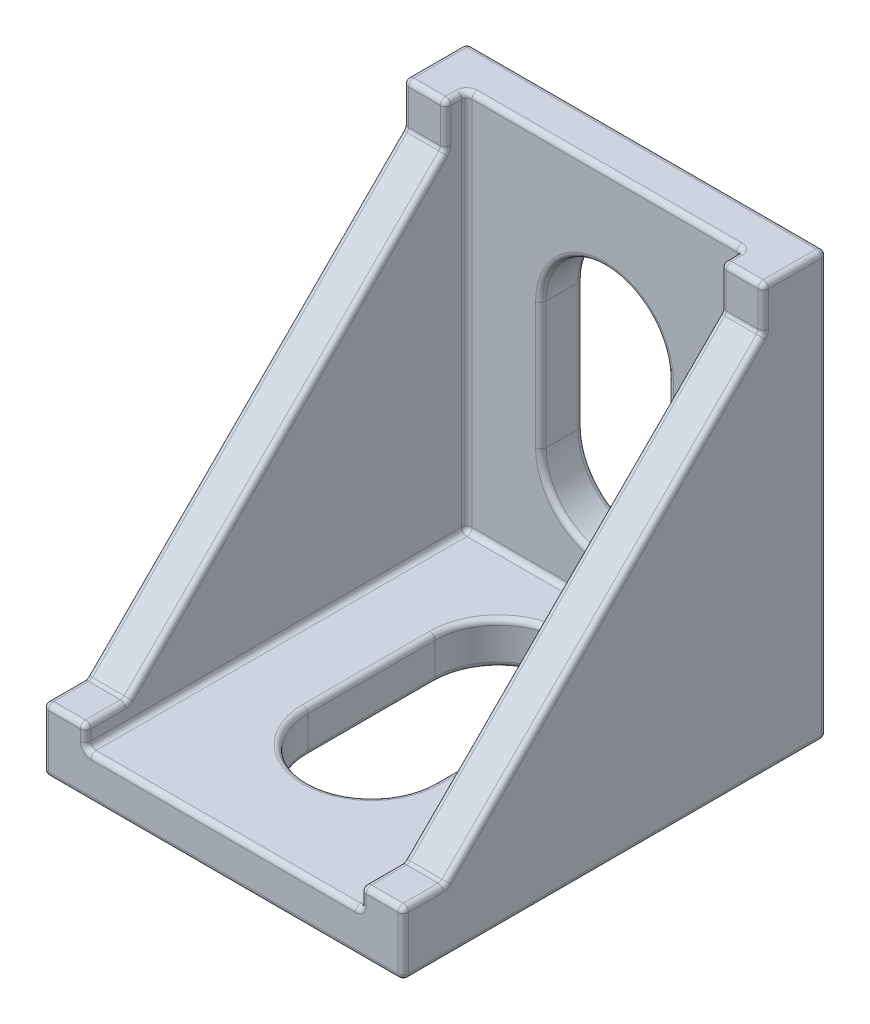
from build123d import *

# Parameters (mm, degrees)
BASE_DEPTH         = 2
SIDES_DEPTH        = 18
NUBS_BOTTOM_DEPTH  = 1
NUBS_REAR_DEPTH    = 1
SIDE_CUT_REACH     = 35.615
REAR_SLOT_DEPTH    = 34
COSMETIC_FILLETS_R = 0.25


with BuildPart() as part:
    # Base Sketch → Base (new body)
    with BuildSketch(Plane(origin=(0, 0, 0), x_dir=(1, 0, 0), z_dir=(0, 1, 0))):
        Polygon((0, 0), (2, 0), (15, 0), (17, 0), (17, 20), (0, 20), align=None)
        with BuildLine():
            Line((5.5, 13), (5.5, 7))
            ThreePointArc((5.5, 7), (8.5, 4), (11.5, 7))
            Line((11.5, 7), (11.5, 13))
            ThreePointArc((11.5, 13), (8.5, 16), (5.5, 13))
        make_face(mode=Mode.SUBTRACT)
    extrude(amount=BASE_DEPTH)

    # MainUprightSketch → Sides (add)
    with BuildSketch(Plane(origin=(0, 2, 0), x_dir=(1, 0, 0), z_dir=(0, 1, 0))):
        Polygon((17, 0), (17, 20), (0, 20), (0, 0), (2, 0), (2, 18), (15, 18), (15, 0), align=None)
    extrude(amount=SIDES_DEPTH)

    # NubsSketch → Nubs-Bottom (add)
    with BuildSketch(Plane(origin=(0, 0, 0), x_dir=(1, 0, 0), z_dir=(0, 1, 0))):
        with BuildLine():
            Line((7, 19), (10, 19))
            ThreePointArc((10, 19), (11, 18), (10, 17))
            Line((10, 17), (7, 17))
            ThreePointArc((7, 17), (6, 18), (7, 19))
        make_face()
        with BuildLine():
            Line((7, 1), (10, 1))
            ThreePointArc((10, 1), (11, 2), (10, 3))
            Line((10, 3), (7, 3))
            ThreePointArc((7, 3), (6, 2), (7, 1))
        make_face()
    extrude(amount=-NUBS_BOTTOM_DEPTH)

    # RearNubsSketch → Nubs-Rear (add)
    with BuildSketch(Plane.XY.offset(-20)):
        with BuildLine():
            Line((10, 3), (7, 3))
            ThreePointArc((7, 3), (6, 2), (7, 1))
            Line((7, 1), (10, 1))
            ThreePointArc((10, 1), (11, 2), (10, 3))
        make_face()
        with BuildLine():
            Line((10, 19), (7, 19))
            ThreePointArc((7, 19), (6, 18), (7, 17))
            Line((7, 17), (10, 17))
            ThreePointArc((10, 17), (11, 18), (10, 19))
        make_face()
    extrude(amount=-NUBS_REAR_DEPTH)

    # Cutaway Sketch → Side Cut (cut, up to next)
    with BuildSketch(Plane(origin=(0, 0, 0), x_dir=(0, 0, -1), z_dir=(1, 0, 0)), mode=Mode.PRIVATE) as side_cut_sk1:
        Polygon((0, 3), (2, 3), (17, 18), (17, 20), (0, 20), align=None)
    side_cut_tool1 = extrude(side_cut_sk1.sketch, amount=SIDE_CUT_REACH, mode=Mode.PRIVATE) & part.part
    add(side_cut_tool1.solids().sort_by_distance((0, 13.730878, -6.269122))[0], mode=Mode.SUBTRACT)
    add(side_cut_tool1.solids().sort_by_distance((0, 13.730878, -6.269122))[1], mode=Mode.SUBTRACT)

    # RearSlotSketch → Rear Slot (cut, through all)
    with BuildSketch(Plane.XY.offset(-20)):
        with BuildLine():
            Line((5.5, 13), (5.5, 7))
            ThreePointArc((5.5, 7), (8.5, 4), (11.5, 7))
            Line((11.5, 7), (11.5, 13))
            ThreePointArc((11.5, 13), (8.5, 16), (5.5, 13))
        make_face()
    extrude(amount=REAR_SLOT_DEPTH, mode=Mode.SUBTRACT)

    # Cosmetic Fillets
    cosmetic_fillets_edges = [part.edges().sort_by_distance(p)[0] for p in [
        (11, 2, -21),
        (8.5, 1, -21),
        (6, 2, -20),
        (8.5, 1, -20),
        (11, 2, -20),
        (8.5, 3, -20),
        (11, 18, -21),
        (8.5, 17, -21),
        (6, 18, -21),
        (8.5, 19, -21),
        (11, 18, -20),
        (8.5, 19, -20),
        (6, 18, -20),
        (8.5, 17, -20),
        (17, 20, -18.5),
        (2, 20, -17.5),
        (1, 20, -17),
        (15, 2.5, 0),
        (15, 10.5, -9.5),
        (15, 3, -1),
        (2, 2.5, 0),
        (0, 1.5, 0),
        (17, 1.5, 0),
        (1, 3, 0),
        (0, 3, -1),
        (16, 3, 0),
        (1, 3, -2),
        (0, 10.5, -9.5),
        (16, 3, -2),
        (16, 20, -17),
        (1, 18, -17),
        (0, 19, -17),
        (16, 18, -17),
        (2, 3, -1),
        (2, 10.5, -9.5),
        (2, 19, -17),
        (15, 19, -17),
        (17, 3, -1),
        (17, 10.5, -9.5),
        (17, 19, -17),
        (5.5, 10, -18),
        (8.5, 16, -18),
        (11.5, 10, -18),
        (8.5, 4, -18),
        (8.5, 4, -20),
        (11.5, 10, -20),
        (8.5, 16, -20),
        (5.5, 10, -20),
        (8.5, 0, -4),
        (11.5, 0, -10),
        (8.5, 0, -16),
        (5.5, 0, -10),
        (5.5, 2, -10),
        (0, 10, -20),
        (17, 10, -20),
        (8.5, 2, -4),
        (11.5, 2, -10),
        (8.5, 2, -16),
        (8.5, 2, 0),
        (2, 2, -9),
        (2, 11, -18),
        (8.5, 2, -18),
        (15, 11, -18),
        (15, 2, -9),
        (15, 20, -17.5),
        (8.5, 20, -20),
        (0, 20, -18.5),
        (8.5, 20, -18),
        (8.5, 0, -20),
        (17, 0, -10),
        (6, -1, -18),
        (8.5, -1, -19),
        (11, -1, -18),
        (8.5, 0, 0),
        (8.5, -1, -17),
        (6, 0, -18),
        (8.5, 0, -17),
        (11, 0, -18),
        (8.5, 0, -19),
        (11, -1, -2),
        (8.5, -1, -1),
        (6, -1, -2),
        (8.5, -1, -3),
        (11, 0, -2),
        (8.5, 0, -3),
        (0, 0, -10),
        (6, 0, -2),
        (8.5, 0, -1),
        (6, 2, -21),
        (8.5, 3, -21),
    ]]
    fillet(cosmetic_fillets_edges, radius=COSMETIC_FILLETS_R)


solid = part.part
